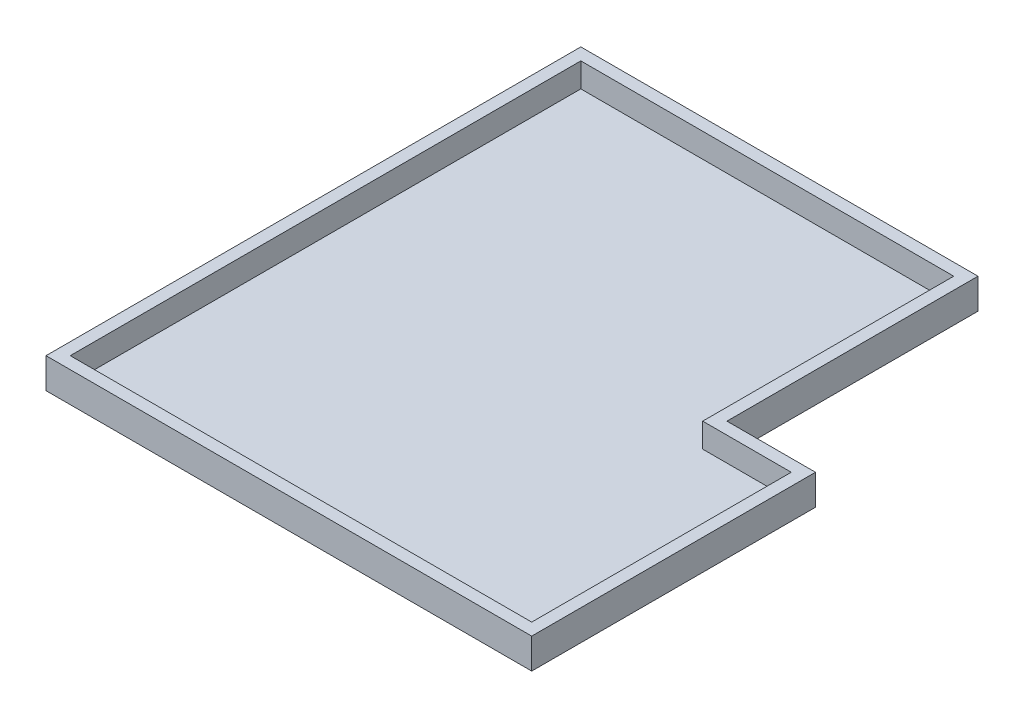
from build123d import *

# Parameters (mm, degrees)
BOSS_EXTRUDE3_DEPTH = 50
BOSS_EXTRUDE4_DEPTH = 250


with BuildPart() as part:
    # Sketch2 → Boss-Extrude3 (new body)
    with BuildSketch(Plane(origin=(0, 0, 0), x_dir=(1, 0, 0), z_dir=(0, 1, 0))):
        Polygon((-1637.5, 2105), (-1637.5, -2105), (-1637.5, -2205), (2267.5, -2205), (2367.5, -2205), (2367.5, 135), (2267.5, 135), (1637.5, 135), (1637.5, 2205), (1537.5, 2205), (-1637.5, 2205), align=None)
    extrude(amount=BOSS_EXTRUDE3_DEPTH)

    # Sketch2<6> → Boss-Extrude4 (add)
    with BuildSketch(Plane(origin=(0, 0, 0), x_dir=(1, 0, 0), z_dir=(0, 1, 0))):
        Polygon((2367.5, 135), (2267.5, 135), (1637.5, 135), (1637.5, 2205), (1537.5, 2205), (-1637.5, 2205), (-1637.5, 2105), (-1637.5, -2105), (-1637.5, -2205), (2267.5, -2205), (2367.5, -2205), align=None)
        Polygon((1537.5, -2105), (-1537.5, -2105), (-1537.5, 2105), (1537.5, 2105), (1537.5, 135), (1537.5, 35), (1637.5, 35), (2267.5, 35), (2267.5, -2105), align=None, mode=Mode.SUBTRACT)
    extrude(amount=BOSS_EXTRUDE4_DEPTH)


solid = part.part
